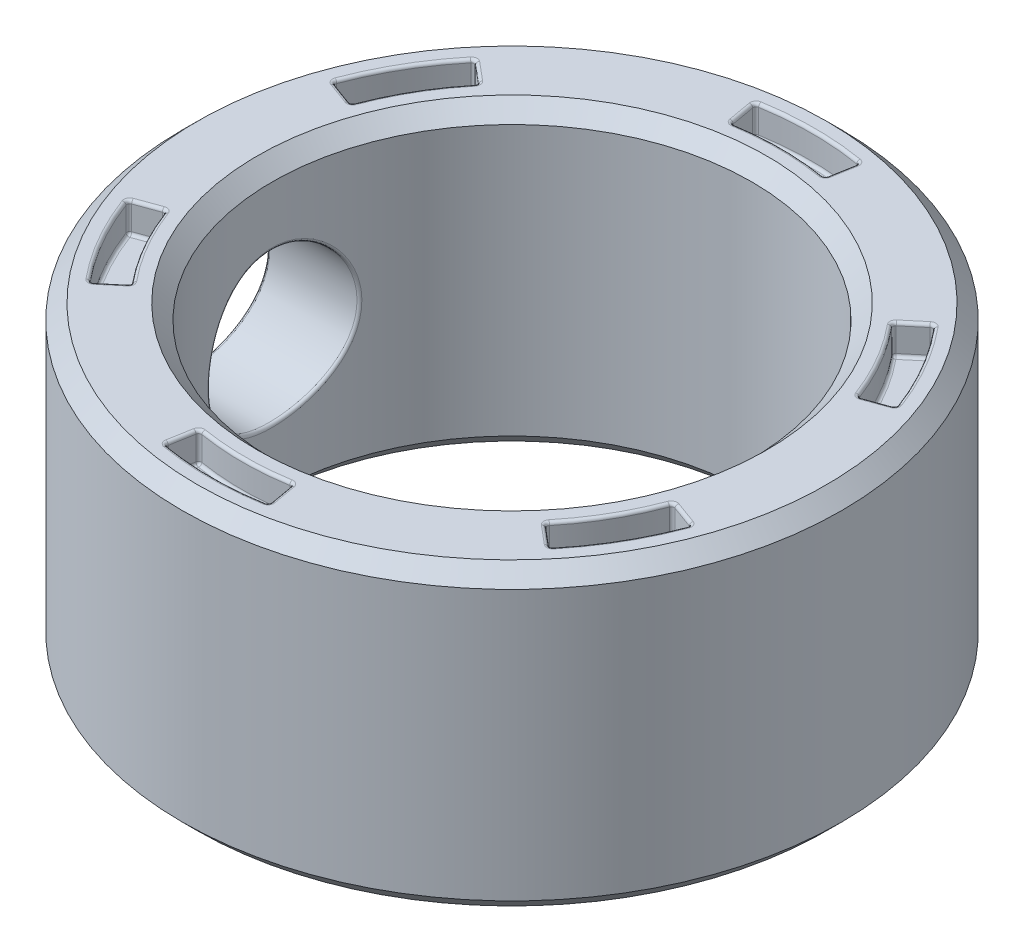
from build123d import *

# Parameters (mm, degrees)
SKETCH1_R                = 11
SKETCH1_R_2              = 8
BOSS_EXTRUDE1_DEPTH      = 10
CHAMFER1_SIZE            = 0.5
CUT_EXTRUDE1_DEPTH       = 1
FILLET1_R                = 0.1
CIRPATTERN1_COUNT        = 6
FILLET1_OF_CIRPATTERN1_R = 0.1
CUT_EXTRUDE2_REACH       = 20.493
CUT_EXTRUDE2_END_RADIUS  = 11
SKETCH3_R                = 2.5
FILLET2_R                = 0.1


with BuildPart() as part:
    # Sketch1 → Boss-Extrude1 (new body)
    with BuildSketch(Plane(origin=(0, 0, 0), x_dir=(1, 0, 0), z_dir=(0, 1, 0))):
        with Locations(Location((0, 0, 0), (0, 0, 270))):
            Circle(SKETCH1_R)
        with Locations(Location((0, 0, 0), (0, 0, 270))):
            Circle(SKETCH1_R_2, mode=Mode.SUBTRACT)
    extrude(amount=BOSS_EXTRUDE1_DEPTH)

    # Chamfer1
    chamfer1_edges = [part.edges().sort_by_distance(p)[0] for p in [
        (0, 0, -11),
        (0, 10, -11),
        (0, 0, -8),
        (0, 10, -8),
    ]]
    chamfer(chamfer1_edges, length=CHAMFER1_SIZE)

    # Sketch2 → Cut-Extrude1 (cut)
    with BuildSketch(Plane(origin=(0, 10, 0), x_dir=(1, 0, 0), z_dir=(0, 1, 0))):
        with BuildLine():
            Line((-1.736481777, 9.84807753), (-1.562833599, 8.863269777))
            ThreePointArc((-1.562833599, 8.863269777), (0, 9), (1.562833599, 8.863269777))
            Line((1.562833599, 8.863269777), (1.736481777, 9.84807753))
            ThreePointArc((1.736481777, 9.84807753), (0, 10), (-1.736481777, 9.84807753))
        make_face()
    cut_extrude1 = extrude(amount=-CUT_EXTRUDE1_DEPTH, mode=Mode.SUBTRACT)

    # Fillet1
    fillet1_edges = [part.edges().sort_by_distance(p)[0] for p in [
        (0, 9, -10),
        (-1.736481777, 9.5, -9.84807753),
        (1.649657688, 9, -9.355673654),
        (1.736481777, 9.5, -9.84807753),
        (0, 9, -9),
        (1.562833599, 9.5, -8.863269777),
        (-1.649657688, 9, -9.355673654),
        (-1.562833599, 9.5, -8.863269777),
        (0, 10, -10),
        (-1.649657688, 10, -9.355673654),
        (0, 10, -9),
        (1.649657688, 10, -9.355673654),
    ]]
    fillet(fillet1_edges, radius=FILLET1_R)

    # CirPattern1: Cut-Extrude1 ×6 about axis
    cirpattern1_axis = Axis((0, 0, 0), (0, 1, 0))
    for i in range(1, CIRPATTERN1_COUNT):
        add(cut_extrude1.rotate(cirpattern1_axis, i * 360 / CIRPATTERN1_COUNT), mode=Mode.SUBTRACT)

    # Fillet1 of CirPattern1
    fillet1_of_cirpattern1_edges = [part.edges().sort_by_distance(p)[0] for p in [
        (-8.660254038, 9, -5),
        (-9.396926208, 9.5, -3.420201433),
        (-7.27742221, 9, -6.106482292),
        (-7.660444431, 9.5, -6.427876097),
        (-7.794228634, 9, -4.5),
        (-6.894399988, 9.5, -5.785088487),
        (-8.927079897, 9, -3.249191362),
        (-8.457233587, 9.5, -3.07818129),
        (-8.660254038, 10, -5),
        (-8.927079897, 10, -3.249191362),
        (-7.794228634, 10, -4.5),
        (-7.27742221, 10, -6.106482292),
        (-8.660254038, 9, 5),
        (-7.660444431, 9.5, 6.427876097),
        (-8.927079897, 9, 3.249191362),
        (-9.396926208, 9.5, 3.420201433),
        (-7.794228634, 9, 4.5),
        (-8.457233587, 9.5, 3.07818129),
        (-7.27742221, 9, 6.106482292),
        (-6.894399988, 9.5, 5.785088487),
        (-8.660254038, 10, 5),
        (-7.27742221, 10, 6.106482292),
        (-7.794228634, 10, 4.5),
        (-8.927079897, 10, 3.249191362),
        (0, 9, 10),
        (1.736481777, 9.5, 9.84807753),
        (-1.649657688, 9, 9.355673654),
        (-1.736481777, 9.5, 9.84807753),
        (0, 9, 9),
        (-1.562833599, 9.5, 8.863269777),
        (1.649657688, 9, 9.355673654),
        (1.562833599, 9.5, 8.863269777),
        (0, 10, 10),
        (1.649657688, 10, 9.355673654),
        (0, 10, 9),
        (-1.649657688, 10, 9.355673654),
        (8.660254038, 9, 5),
        (9.396926208, 9.5, 3.420201433),
        (7.27742221, 9, 6.106482292),
        (7.660444431, 9.5, 6.427876097),
        (7.794228634, 9, 4.5),
        (6.894399988, 9.5, 5.785088487),
        (8.927079897, 9, 3.249191362),
        (8.457233587, 9.5, 3.07818129),
        (8.660254038, 10, 5),
        (8.927079897, 10, 3.249191362),
        (7.794228634, 10, 4.5),
        (7.27742221, 10, 6.106482292),
        (8.660254038, 9, -5),
        (7.660444431, 9.5, -6.427876097),
        (8.927079897, 9, -3.249191362),
        (9.396926208, 9.5, -3.420201433),
        (7.794228634, 9, -4.5),
        (8.457233587, 9.5, -3.07818129),
        (7.27742221, 9, -6.106482292),
        (6.894399988, 9.5, -5.785088487),
        (8.660254038, 10, -5),
        (7.27742221, 10, -6.106482292),
        (7.794228634, 10, -4.5),
        (8.927079897, 10, -3.249191362),
    ]]
    fillet(fillet1_of_cirpattern1_edges, radius=FILLET1_OF_CIRPATTERN1_R)

    # Cut-Extrude2: up to this cylinder (the profile starts inside it)
    cut_extrude2_end = Plane(origin=(0, 5, 0), z_dir=(0, -1, 0)) * Cylinder(CUT_EXTRUDE2_END_RADIUS, 63.986, mode=Mode.PRIVATE)
    # Sketch3 → Cut-Extrude2 (cut, up to the surface)
    with BuildSketch(Plane(origin=(0, 0, 0), x_dir=(0, 0, -1), z_dir=(1, 0, 0)), mode=Mode.PRIVATE) as cut_extrude2_sk1:
        with Locations((0, 5)):
            Circle(SKETCH3_R)
    cut_extrude2_tool1 = extrude(cut_extrude2_sk1.sketch, amount=-CUT_EXTRUDE2_REACH, mode=Mode.PRIVATE) & cut_extrude2_end
    add(cut_extrude2_tool1.solids().sort_by_distance((0, 5, 0))[0], mode=Mode.SUBTRACT)

    # Fillet2
    fillet2_edges = [part.edges().sort_by_distance(p)[0] for p in [
        (-7.599342083, 5, 2.500000003),
        (-10.712142637, 4.999999996, 2.500000048),
    ]]
    fillet(fillet2_edges, radius=FILLET2_R)


solid = part.part
